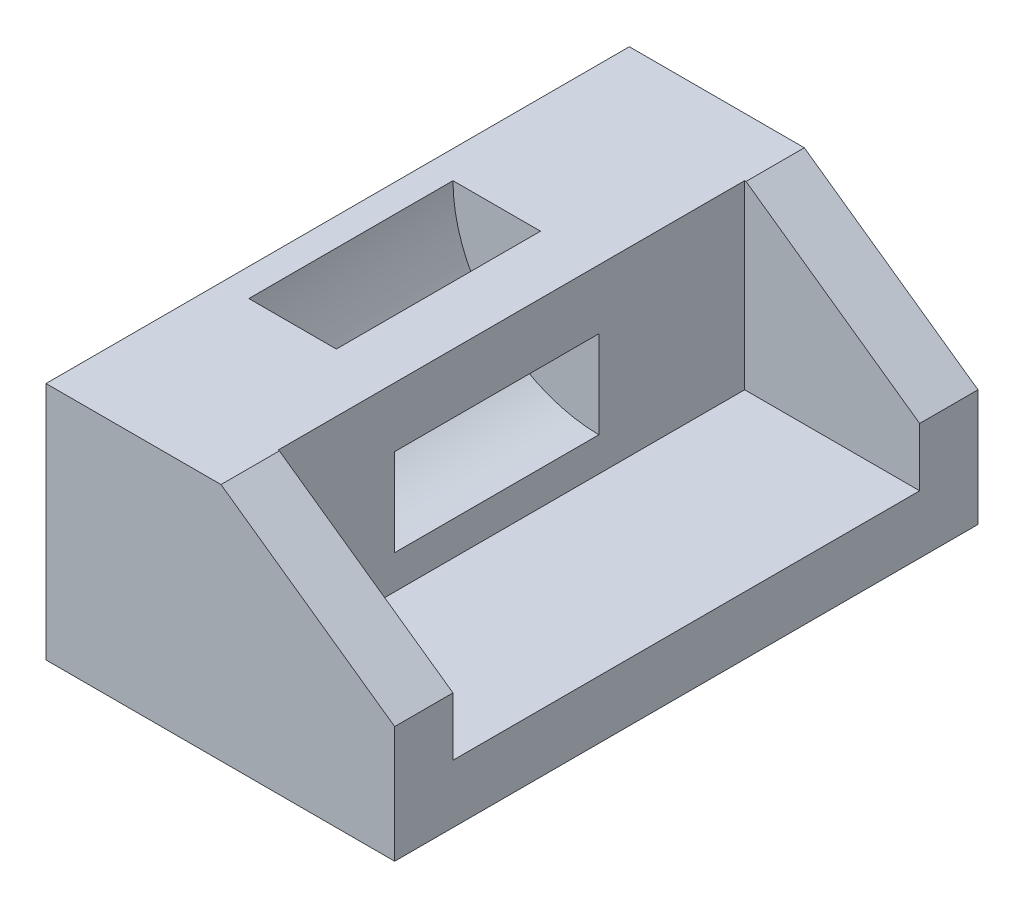
from build123d import *

# Parameters (mm, degrees)
BOSS_EXTRUDE1_DEPTH = 50
SKETCH4_W           = 40
SKETCH4_H           = 15.522388441
CUT_EXTRUDE1_DEPTH  = 15
SKETCH5_W           = 7.5
SKETCH5_H           = 17.5


with BuildPart() as part:
    # Sketch1 → Boss-Extrude1 (new body)
    with BuildSketch(Plane.XY):
        Polygon((0, 0), (0, 20.522388441), (15, 20.522388441), (29.885137085, 10), (29.885137085, 0), align=None)
    extrude(amount=BOSS_EXTRUDE1_DEPTH)

    # Sketch4 → Cut-Extrude1 (cut)
    with BuildSketch(Plane(origin=(29.885137085, 0, 0), x_dir=(0, 0, -1), z_dir=(1, 0, 0))):
        with Locations((-25, 12.761194221)):
            Rectangle(SKETCH4_W, SKETCH4_H)
    extrude(amount=-CUT_EXTRUDE1_DEPTH, mode=Mode.SUBTRACT)

    # Sketch5 → Cut-Revolve1 (revolve, cut)
    with BuildSketch(Plane(origin=(0, 20.522388441, 0), x_dir=(1, 0, 0), z_dir=(0, 1, 0))):
        with Locations((6.135137085, -26.25)):
            Rectangle(SKETCH5_W, SKETCH5_H)
    revolve(axis=Axis((15, 20.522388441, 50), (0, 0, -1)), mode=Mode.SUBTRACT)


solid = part.part
